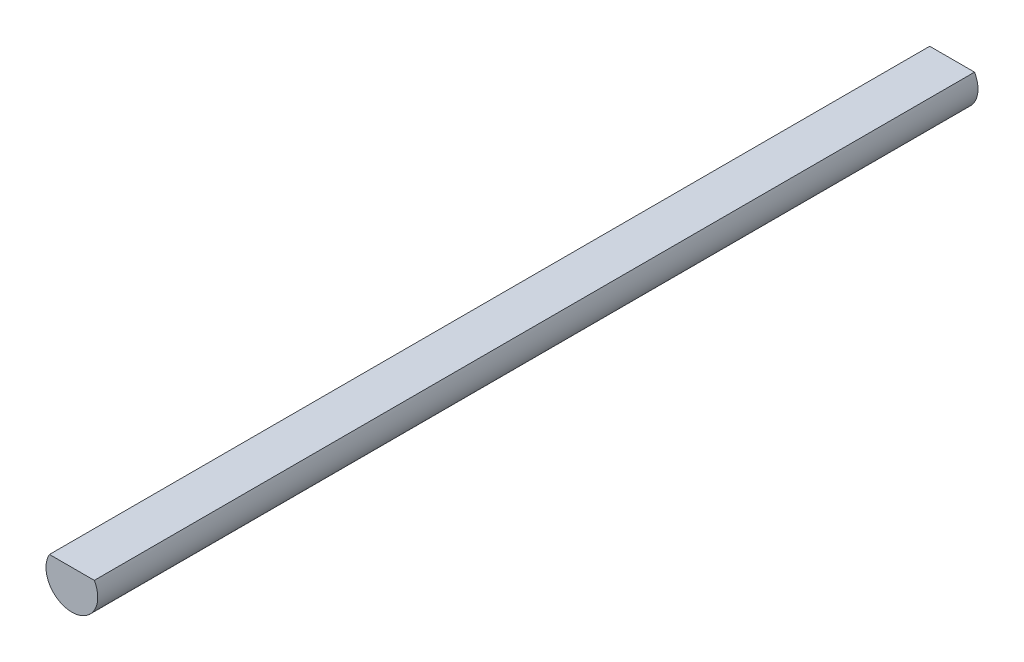
from build123d import *

# Parameters (mm, degrees)
BOSS_EXTRUDE1_DEPTH = 215.9


with BuildPart() as part:
    # Sketch1 → Boss-Extrude1 (new body)
    with BuildSketch(Plane.XY):
        with BuildLine():
            Line((-5.4991, 3.175279388), (5.4991, 3.175279388))
            ThreePointArc((5.4991, 3.175279388), (0, -6.35), (-5.4991, 3.175279388))
        make_face()
    extrude(amount=BOSS_EXTRUDE1_DEPTH)


solid = part.part
